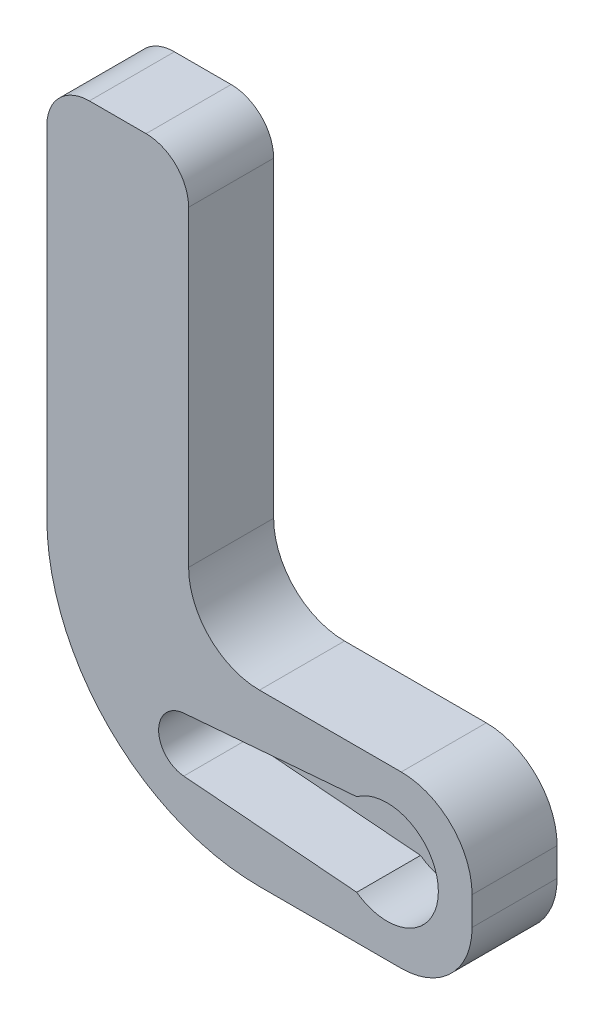
from build123d import *

# Parameters (mm, degrees)
BOSS_EXTRUDE1_DEPTH = 6
FILLET1_R           = 5
FILLET2_R           = 15
FILLET3_R           = 5
FILLET4_R           = 5
FILLET5_R           = 3
FILLET6_R           = 3
CUT_EXTRUDE1_DEPTH  = 4.5
SKETCH3_R           = 1.5
CUT_EXTRUDE2_DEPTH  = 5


with BuildPart() as part:
    # Sketch2 → Boss-Extrude1 (new body)
    with BuildSketch(Plane.XY):
        Polygon((-14, 6), (6, 6), (6, -6), (-24, -6), (-24, 6), (-24, 36), (-14, 36), align=None)
    extrude(amount=-BOSS_EXTRUDE1_DEPTH)

    # Fillet1
    fillet1_edges = [part.edges().sort_by_distance(p)[0] for p in [
        (-14, 6, -3),
    ]]
    fillet(fillet1_edges, radius=FILLET1_R)

    # Fillet2
    fillet2_edges = [part.edges().sort_by_distance(p)[0] for p in [
        (-24, -6, -3),
    ]]
    fillet(fillet2_edges, radius=FILLET2_R)

    # Fillet3
    fillet3_edges = [part.edges().sort_by_distance(p)[0] for p in [
        (6, 6, -3),
    ]]
    fillet(fillet3_edges, radius=FILLET3_R)

    # Fillet4
    fillet4_edges = [part.edges().sort_by_distance(p)[0] for p in [
        (6, -6, -3),
    ]]
    fillet(fillet4_edges, radius=FILLET4_R)

    # Fillet5
    fillet5_edges = [part.edges().sort_by_distance(p)[0] for p in [
        (-14, 36, -3),
    ]]
    fillet(fillet5_edges, radius=FILLET5_R)

    # Fillet6
    fillet6_edges = [part.edges().sort_by_distance(p)[0] for p in [
        (-24, 36, -3),
    ]]
    fillet(fillet6_edges, radius=FILLET6_R)

    # Sketch1 → Cut-Extrude1 (cut)
    with BuildSketch(Plane.XY):
        with BuildLine():
            Line((-14.343060397, 1.923598719), (-2.139626136, 2.92))
            ThreePointArc((-2.139626136, 2.92), (3.62, 0), (-2.139626136, -2.92))
            Line((-2.139626136, -2.92), (-14.343060397, -1.923598719))
            ThreePointArc((-14.343060397, -1.923598719), (-16.116, 0), (-14.343060397, 1.923598719))
        make_face()
    extrude(amount=-CUT_EXTRUDE1_DEPTH, mode=Mode.SUBTRACT)

    # Sketch3 → Cut-Extrude2 (cut)
    with BuildSketch(Plane.XY.offset(-4.5)):
        Circle(SKETCH3_R)
    extrude(amount=-CUT_EXTRUDE2_DEPTH, mode=Mode.SUBTRACT)


solid = part.part
